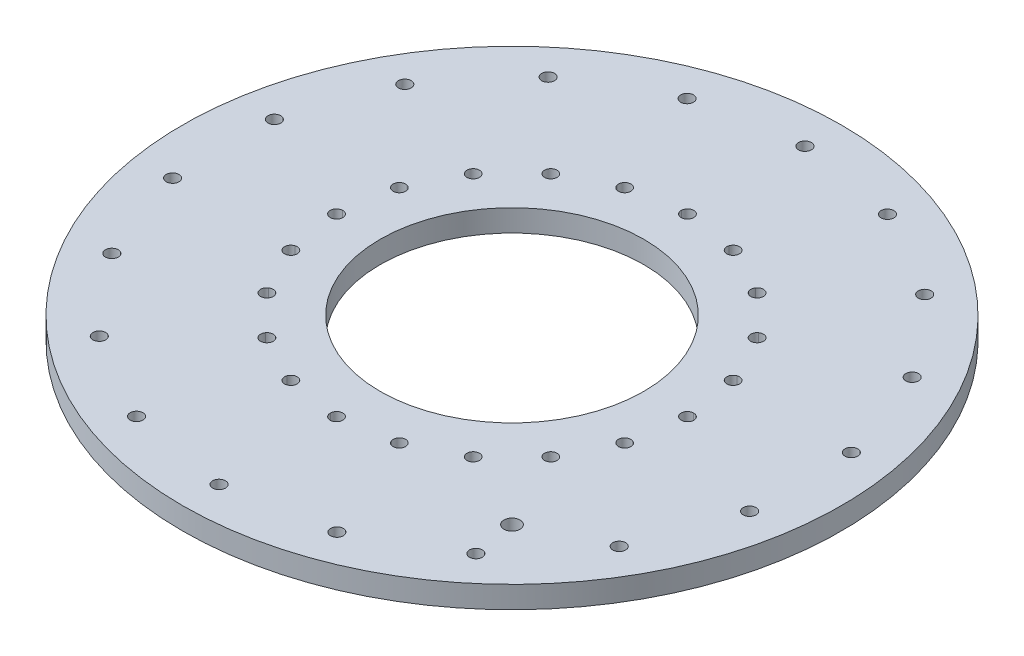
from build123d import *

# Parameters (mm, degrees)
SKETCH_1_R               = 450
EXTRUDE_1_DEPTH          = 30
CUT_EXTRUDE_1_REACH      = 639.103
SKETCH_2_R               = 8.5
CUT_EXTRUDE_2_REACH      = 639.103
SKETCH_3_R               = 180
SKETCH_7_R               = 8.5
CUT_EXTRUDE_5_DEPTH      = 30
CUT_EXTRUDE_6_REACH      = 639.103
SKETCH_9_R               = 8.5
PATTERN_CIRCULAR_3_COUNT = 18
SKETCH_11_R              = 11
CUT_EXTRUDE_7_DEPTH      = 638.102817448
HOLE_WIZARD_M16_8_D      = 17.5
PATTERN_CIRCULAR_5_COUNT = 18


with BuildPart() as part:
    # 草图1 → 凸台-拉伸1 (new body)
    with BuildSketch(Plane(origin=(0, 0, 0), x_dir=(1, 0, 0), z_dir=(0, 1, 0))):
        with Locations(Location((0, 0, 0), (0, 0, 270))):
            Circle(SKETCH_1_R)
    extrude(amount=EXTRUDE_1_DEPTH)

    # 草图2 → 切除-拉伸1 (cut, up to next)
    with BuildSketch(Plane(origin=(0, 30, 0), x_dir=(1, 0, 0), z_dir=(0, 1, 0)), mode=Mode.PRIVATE) as cut_extrude_1_sk1:
        with Locations(Location((0, 239.5, 0), (0, 0, 270))):
            Circle(SKETCH_2_R)
    cut_extrude_1_tool1 = extrude(cut_extrude_1_sk1.sketch, amount=-CUT_EXTRUDE_1_REACH, mode=Mode.PRIVATE) & part.part
    # 草图2 → 切除-拉伸1 (cut, up to next)
    with BuildSketch(Plane(origin=(0, 30, 0), x_dir=(1, 0, 0), z_dir=(0, 1, 0)), mode=Mode.PRIVATE) as cut_extrude_1_sk2:
        with Locations(Location((74.009570153, 227.778035653, 0), (0, 0, 270))):
            Circle(SKETCH_2_R)
    cut_extrude_1_tool2 = extrude(cut_extrude_1_sk2.sketch, amount=-CUT_EXTRUDE_1_REACH, mode=Mode.PRIVATE) & part.part
    # 草图2 → 切除-拉伸1 (cut, up to next)
    with BuildSketch(Plane(origin=(0, 30, 0), x_dir=(1, 0, 0), z_dir=(0, 1, 0)), mode=Mode.PRIVATE) as cut_extrude_1_sk3:
        with Locations(Location((140.774567924, 193.759570153, 0), (0, 0, 270))):
            Circle(SKETCH_2_R)
    cut_extrude_1_tool3 = extrude(cut_extrude_1_sk3.sketch, amount=-CUT_EXTRUDE_1_REACH, mode=Mode.PRIVATE) & part.part
    # 草图2 → 切除-拉伸1 (cut, up to next)
    with BuildSketch(Plane(origin=(0, 30, 0), x_dir=(1, 0, 0), z_dir=(0, 1, 0)), mode=Mode.PRIVATE) as cut_extrude_1_sk4:
        with Locations(Location((193.759570153, 140.774567924, 0), (0, 0, 270))):
            Circle(SKETCH_2_R)
    cut_extrude_1_tool4 = extrude(cut_extrude_1_sk4.sketch, amount=-CUT_EXTRUDE_1_REACH, mode=Mode.PRIVATE) & part.part
    # 草图2 → 切除-拉伸1 (cut, up to next)
    with BuildSketch(Plane(origin=(0, 30, 0), x_dir=(1, 0, 0), z_dir=(0, 1, 0)), mode=Mode.PRIVATE) as cut_extrude_1_sk5:
        with Locations(Location((227.778035653, 74.009570153, 0), (0, 0, 270))):
            Circle(SKETCH_2_R)
    cut_extrude_1_tool5 = extrude(cut_extrude_1_sk5.sketch, amount=-CUT_EXTRUDE_1_REACH, mode=Mode.PRIVATE) & part.part
    # 草图2 → 切除-拉伸1 (cut, up to next)
    with BuildSketch(Plane(origin=(0, 30, 0), x_dir=(1, 0, 0), z_dir=(0, 1, 0)), mode=Mode.PRIVATE) as cut_extrude_1_sk6:
        with Locations(Location((239.5, 0, 0), (0, 0, 270))):
            Circle(SKETCH_2_R)
    cut_extrude_1_tool6 = extrude(cut_extrude_1_sk6.sketch, amount=-CUT_EXTRUDE_1_REACH, mode=Mode.PRIVATE) & part.part
    # 草图2 → 切除-拉伸1 (cut, up to next)
    with BuildSketch(Plane(origin=(0, 30, 0), x_dir=(1, 0, 0), z_dir=(0, 1, 0)), mode=Mode.PRIVATE) as cut_extrude_1_sk7:
        with Locations(Location((227.778035653, -74.009570153, 0), (0, 0, 270))):
            Circle(SKETCH_2_R)
    cut_extrude_1_tool7 = extrude(cut_extrude_1_sk7.sketch, amount=-CUT_EXTRUDE_1_REACH, mode=Mode.PRIVATE) & part.part
    # 草图2 → 切除-拉伸1 (cut, up to next)
    with BuildSketch(Plane(origin=(0, 30, 0), x_dir=(1, 0, 0), z_dir=(0, 1, 0)), mode=Mode.PRIVATE) as cut_extrude_1_sk8:
        with Locations(Location((193.759570153, -140.774567924, 0), (0, 0, 270))):
            Circle(SKETCH_2_R)
    cut_extrude_1_tool8 = extrude(cut_extrude_1_sk8.sketch, amount=-CUT_EXTRUDE_1_REACH, mode=Mode.PRIVATE) & part.part
    # 草图2 → 切除-拉伸1 (cut, up to next)
    with BuildSketch(Plane(origin=(0, 30, 0), x_dir=(1, 0, 0), z_dir=(0, 1, 0)), mode=Mode.PRIVATE) as cut_extrude_1_sk9:
        with Locations(Location((140.774567924, -193.759570153, 0), (0, 0, 270))):
            Circle(SKETCH_2_R)
    cut_extrude_1_tool9 = extrude(cut_extrude_1_sk9.sketch, amount=-CUT_EXTRUDE_1_REACH, mode=Mode.PRIVATE) & part.part
    # 草图2 → 切除-拉伸1 (cut, up to next)
    with BuildSketch(Plane(origin=(0, 30, 0), x_dir=(1, 0, 0), z_dir=(0, 1, 0)), mode=Mode.PRIVATE) as cut_extrude_1_sk10:
        with Locations(Location((74.009570153, -227.778035653, 0), (0, 0, 270))):
            Circle(SKETCH_2_R)
    cut_extrude_1_tool10 = extrude(cut_extrude_1_sk10.sketch, amount=-CUT_EXTRUDE_1_REACH, mode=Mode.PRIVATE) & part.part
    # 草图2 → 切除-拉伸1 (cut, up to next)
    with BuildSketch(Plane(origin=(0, 30, 0), x_dir=(1, 0, 0), z_dir=(0, 1, 0)), mode=Mode.PRIVATE) as cut_extrude_1_sk11:
        with Locations(Location((0, -239.5, 0), (0, 0, 270))):
            Circle(SKETCH_2_R)
    cut_extrude_1_tool11 = extrude(cut_extrude_1_sk11.sketch, amount=-CUT_EXTRUDE_1_REACH, mode=Mode.PRIVATE) & part.part
    # 草图2 → 切除-拉伸1 (cut, up to next)
    with BuildSketch(Plane(origin=(0, 30, 0), x_dir=(1, 0, 0), z_dir=(0, 1, 0)), mode=Mode.PRIVATE) as cut_extrude_1_sk12:
        with Locations(Location((-74.009570153, -227.778035653, 0), (0, 0, 270))):
            Circle(SKETCH_2_R)
    cut_extrude_1_tool12 = extrude(cut_extrude_1_sk12.sketch, amount=-CUT_EXTRUDE_1_REACH, mode=Mode.PRIVATE) & part.part
    # 草图2 → 切除-拉伸1 (cut, up to next)
    with BuildSketch(Plane(origin=(0, 30, 0), x_dir=(1, 0, 0), z_dir=(0, 1, 0)), mode=Mode.PRIVATE) as cut_extrude_1_sk13:
        with Locations(Location((-140.774567924, -193.759570153, 0), (0, 0, 270))):
            Circle(SKETCH_2_R)
    cut_extrude_1_tool13 = extrude(cut_extrude_1_sk13.sketch, amount=-CUT_EXTRUDE_1_REACH, mode=Mode.PRIVATE) & part.part
    # 草图2 → 切除-拉伸1 (cut, up to next)
    with BuildSketch(Plane(origin=(0, 30, 0), x_dir=(1, 0, 0), z_dir=(0, 1, 0)), mode=Mode.PRIVATE) as cut_extrude_1_sk14:
        with Locations(Location((-193.759570153, -140.774567924, 0), (0, 0, 270))):
            Circle(SKETCH_2_R)
    cut_extrude_1_tool14 = extrude(cut_extrude_1_sk14.sketch, amount=-CUT_EXTRUDE_1_REACH, mode=Mode.PRIVATE) & part.part
    # 草图2 → 切除-拉伸1 (cut, up to next)
    with BuildSketch(Plane(origin=(0, 30, 0), x_dir=(1, 0, 0), z_dir=(0, 1, 0)), mode=Mode.PRIVATE) as cut_extrude_1_sk15:
        with Locations(Location((-227.778035653, -74.009570153, 0), (0, 0, 270))):
            Circle(SKETCH_2_R)
    cut_extrude_1_tool15 = extrude(cut_extrude_1_sk15.sketch, amount=-CUT_EXTRUDE_1_REACH, mode=Mode.PRIVATE) & part.part
    # 草图2 → 切除-拉伸1 (cut, up to next)
    with BuildSketch(Plane(origin=(0, 30, 0), x_dir=(1, 0, 0), z_dir=(0, 1, 0)), mode=Mode.PRIVATE) as cut_extrude_1_sk16:
        with Locations(Location((-239.5, 0, 0), (0, 0, 270))):
            Circle(SKETCH_2_R)
    cut_extrude_1_tool16 = extrude(cut_extrude_1_sk16.sketch, amount=-CUT_EXTRUDE_1_REACH, mode=Mode.PRIVATE) & part.part
    # 草图2 → 切除-拉伸1 (cut, up to next)
    with BuildSketch(Plane(origin=(0, 30, 0), x_dir=(1, 0, 0), z_dir=(0, 1, 0)), mode=Mode.PRIVATE) as cut_extrude_1_sk17:
        with Locations(Location((-227.778035653, 74.009570153, 0), (0, 0, 270))):
            Circle(SKETCH_2_R)
    cut_extrude_1_tool17 = extrude(cut_extrude_1_sk17.sketch, amount=-CUT_EXTRUDE_1_REACH, mode=Mode.PRIVATE) & part.part
    # 草图2 → 切除-拉伸1 (cut, up to next)
    with BuildSketch(Plane(origin=(0, 30, 0), x_dir=(1, 0, 0), z_dir=(0, 1, 0)), mode=Mode.PRIVATE) as cut_extrude_1_sk18:
        with Locations(Location((-193.759570153, 140.774567924, 0), (0, 0, 270))):
            Circle(SKETCH_2_R)
    cut_extrude_1_tool18 = extrude(cut_extrude_1_sk18.sketch, amount=-CUT_EXTRUDE_1_REACH, mode=Mode.PRIVATE) & part.part
    # 草图2 → 切除-拉伸1 (cut, up to next)
    with BuildSketch(Plane(origin=(0, 30, 0), x_dir=(1, 0, 0), z_dir=(0, 1, 0)), mode=Mode.PRIVATE) as cut_extrude_1_sk19:
        with Locations(Location((-140.774567924, 193.759570153, 0), (0, 0, 270))):
            Circle(SKETCH_2_R)
    cut_extrude_1_tool19 = extrude(cut_extrude_1_sk19.sketch, amount=-CUT_EXTRUDE_1_REACH, mode=Mode.PRIVATE) & part.part
    # 草图2 → 切除-拉伸1 (cut, up to next)
    with BuildSketch(Plane(origin=(0, 30, 0), x_dir=(1, 0, 0), z_dir=(0, 1, 0)), mode=Mode.PRIVATE) as cut_extrude_1_sk20:
        with Locations(Location((-74.009570153, 227.778035653, 0), (0, 0, 270))):
            Circle(SKETCH_2_R)
    cut_extrude_1_tool20 = extrude(cut_extrude_1_sk20.sketch, amount=-CUT_EXTRUDE_1_REACH, mode=Mode.PRIVATE) & part.part
    add(cut_extrude_1_tool1.solids().sort_by_distance((0, 30, -239.5))[0], mode=Mode.SUBTRACT)
    add(cut_extrude_1_tool2.solids().sort_by_distance((74.00957, 30, -227.778036))[0], mode=Mode.SUBTRACT)
    add(cut_extrude_1_tool3.solids().sort_by_distance((140.774568, 30, -193.75957))[0], mode=Mode.SUBTRACT)
    add(cut_extrude_1_tool4.solids().sort_by_distance((193.75957, 30, -140.774568))[0], mode=Mode.SUBTRACT)
    add(cut_extrude_1_tool5.solids().sort_by_distance((227.778036, 30, -74.00957))[0], mode=Mode.SUBTRACT)
    add(cut_extrude_1_tool6.solids().sort_by_distance((239.5, 30, 0))[0], mode=Mode.SUBTRACT)
    add(cut_extrude_1_tool7.solids().sort_by_distance((227.778036, 30, 74.00957))[0], mode=Mode.SUBTRACT)
    add(cut_extrude_1_tool8.solids().sort_by_distance((193.75957, 30, 140.774568))[0], mode=Mode.SUBTRACT)
    add(cut_extrude_1_tool9.solids().sort_by_distance((140.774568, 30, 193.75957))[0], mode=Mode.SUBTRACT)
    add(cut_extrude_1_tool10.solids().sort_by_distance((74.00957, 30, 227.778036))[0], mode=Mode.SUBTRACT)
    add(cut_extrude_1_tool11.solids().sort_by_distance((0, 30, 239.5))[0], mode=Mode.SUBTRACT)
    add(cut_extrude_1_tool12.solids().sort_by_distance((-74.00957, 30, 227.778036))[0], mode=Mode.SUBTRACT)
    add(cut_extrude_1_tool13.solids().sort_by_distance((-140.774568, 30, 193.75957))[0], mode=Mode.SUBTRACT)
    add(cut_extrude_1_tool14.solids().sort_by_distance((-193.75957, 30, 140.774568))[0], mode=Mode.SUBTRACT)
    add(cut_extrude_1_tool15.solids().sort_by_distance((-227.778036, 30, 74.00957))[0], mode=Mode.SUBTRACT)
    add(cut_extrude_1_tool16.solids().sort_by_distance((-239.5, 30, 0))[0], mode=Mode.SUBTRACT)
    add(cut_extrude_1_tool17.solids().sort_by_distance((-227.778036, 30, -74.00957))[0], mode=Mode.SUBTRACT)
    add(cut_extrude_1_tool18.solids().sort_by_distance((-193.75957, 30, -140.774568))[0], mode=Mode.SUBTRACT)
    add(cut_extrude_1_tool19.solids().sort_by_distance((-140.774568, 30, -193.75957))[0], mode=Mode.SUBTRACT)
    add(cut_extrude_1_tool20.solids().sort_by_distance((-74.00957, 30, -227.778036))[0], mode=Mode.SUBTRACT)

    # 草图3 → 切除-拉伸2 (cut, up to next)
    with BuildSketch(Plane(origin=(0, 30, 0), x_dir=(1, 0, 0), z_dir=(0, 1, 0)), mode=Mode.PRIVATE) as cut_extrude_2_sk1:
        with Locations(Location((0, 0, 0), (0, 0, 270))):
            Circle(SKETCH_3_R)
    cut_extrude_2_tool1 = extrude(cut_extrude_2_sk1.sketch, amount=-CUT_EXTRUDE_2_REACH, mode=Mode.PRIVATE) & part.part
    add(cut_extrude_2_tool1.solids().sort_by_distance((0, 30, 0))[0], mode=Mode.SUBTRACT)

    # 草图7 → 切除-拉伸5 (cut)
    with BuildSketch(Plane.XZ):
        with Locations((239.715, 0)):
            Circle(SKETCH_7_R)
        with Locations((227.982512804, -74.076008807)):
            Circle(SKETCH_7_R)
        with Locations((193.933508807, -140.900941753)):
            Circle(SKETCH_7_R)
        with Locations((140.900941753, -193.933508807)):
            Circle(SKETCH_7_R)
        with Locations((74.076008807, -227.982512804)):
            Circle(SKETCH_7_R)
        with Locations((0, -239.715)):
            Circle(SKETCH_7_R)
        with Locations((-74.076008807, -227.982512804)):
            Circle(SKETCH_7_R)
        with Locations((-140.900941753, -193.933508807)):
            Circle(SKETCH_7_R)
        with Locations((-193.933508807, -140.900941753)):
            Circle(SKETCH_7_R)
        with Locations((-227.982512804, -74.076008807)):
            Circle(SKETCH_7_R)
        with Locations((-239.715, 0)):
            Circle(SKETCH_7_R)
        with Locations((-227.982512804, 74.076008807)):
            Circle(SKETCH_7_R)
        with Locations((-193.933508807, 140.900941753)):
            Circle(SKETCH_7_R)
        with Locations((-140.900941753, 193.933508807)):
            Circle(SKETCH_7_R)
        with Locations((-74.076008807, 227.982512804)):
            Circle(SKETCH_7_R)
        with Locations((0, 239.715)):
            Circle(SKETCH_7_R)
        with Locations((74.076008807, 227.982512804)):
            Circle(SKETCH_7_R)
        with Locations((140.900941753, 193.933508807)):
            Circle(SKETCH_7_R)
        with Locations((193.933508807, 140.900941753)):
            Circle(SKETCH_7_R)
        with Locations((227.982512804, 74.076008807)):
            Circle(SKETCH_7_R)
    extrude(amount=-CUT_EXTRUDE_5_DEPTH, mode=Mode.SUBTRACT)

    # 草图9 → 切除-拉伸6 (cut, up to next)
    with BuildSketch(Plane.XZ, mode=Mode.PRIVATE) as cut_extrude_6_sk1:
        with Locations(Location((0, 400, 0), (0, 0, 270))):
            Circle(SKETCH_9_R)
    cut_extrude_6_tool1 = extrude(cut_extrude_6_sk1.sketch, amount=-CUT_EXTRUDE_6_REACH, mode=Mode.PRIVATE) & part.part
    cut_extrude_6 = cut_extrude_6_tool1.solids().sort_by_distance((0, 0, 400))[0]
    add(cut_extrude_6, mode=Mode.SUBTRACT)

    # 阵列(圆周)3: 切除-拉伸6 ×18 about axis
    pattern_circular_3_axis = Axis((0, 0, 0), (0, 1, 0))
    for i in range(1, PATTERN_CIRCULAR_3_COUNT):
        add(cut_extrude_6.rotate(pattern_circular_3_axis, i * 360 / PATTERN_CIRCULAR_3_COUNT), mode=Mode.SUBTRACT)

    # 草图11 → 切除-拉伸7 (cut, through all)
    with BuildSketch(Plane(origin=(0, 30, 0), x_dir=(1, 0, 0), z_dir=(0, 1, 0))):
        with Locations(Location((247.487373415, -247.487373415, 0), (0, 0, 270))):
            Circle(SKETCH_11_R)
    extrude(amount=-CUT_EXTRUDE_7_DEPTH, mode=Mode.SUBTRACT)

    # M16 螺纹孔8 (through all)
    with Locations(Plane(origin=(0, 30, 0), x_dir=(1, 0, 0), z_dir=(0, 1, 0))):
        with Locations((0, -400)):
            hole_wizard_m16_8 = Hole(HOLE_WIZARD_M16_8_D / 2)

    # 阵列(圆周)5: M16 螺纹孔8 ×18 about axis
    pattern_circular_5_axis = Axis((0, 0, 0), (0, 1, 0))
    for i in range(1, PATTERN_CIRCULAR_5_COUNT):
        add(hole_wizard_m16_8.rotate(pattern_circular_5_axis, i * 360 / PATTERN_CIRCULAR_5_COUNT), mode=Mode.SUBTRACT)


solid = part.part
